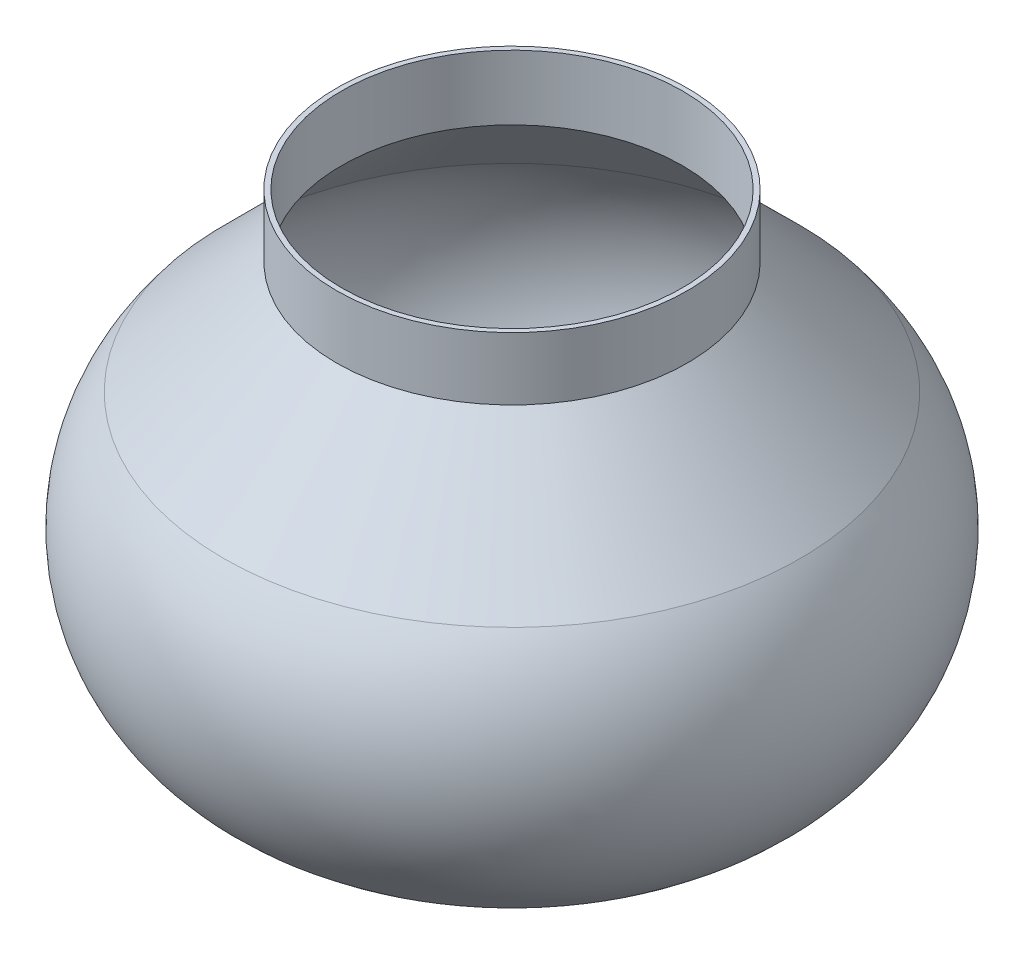
from build123d import *


with BuildPart() as part:
    # Sketch1 → Revolve1 (revolve)
    with BuildSketch(Plane.XY, mode=Mode.PRIVATE) as revolve1_sk:
        with BuildLine():
            Line((0, 0), (71.12, 0))
            ThreePointArc((71.12, 0), (128.798357782, 47.910867335), (116.84, 121.932768447))
            Line((116.84, 121.932768447), (71.107235199, 167.64))
            Line((71.107235199, 167.64), (71.107235199, 193.04))
            Line((71.107235199, 193.04), (69.107235135, 193.04))
            Line((69.107235135, 193.04), (69.107235135, 166.811245686))
            Line((69.107235135, 166.811245686), (115.350199907, 120.594099014))
            ThreePointArc((115.350199907, 120.594099014), (126.937524082, 48.644672186), (70.944125676, 2.000000064))
            Line((70.944125676, 2.000000064), (0, 2.000000064))
            Line((0, 2.000000064), (0, 0))
        make_face()
    revolve(revolve1_sk.sketch.rotate(Axis((0, 167.64, 0), (0, -1, 0)), 90), axis=Axis((0, 167.64, 0), (0, -1, 0)))


solid = part.part
